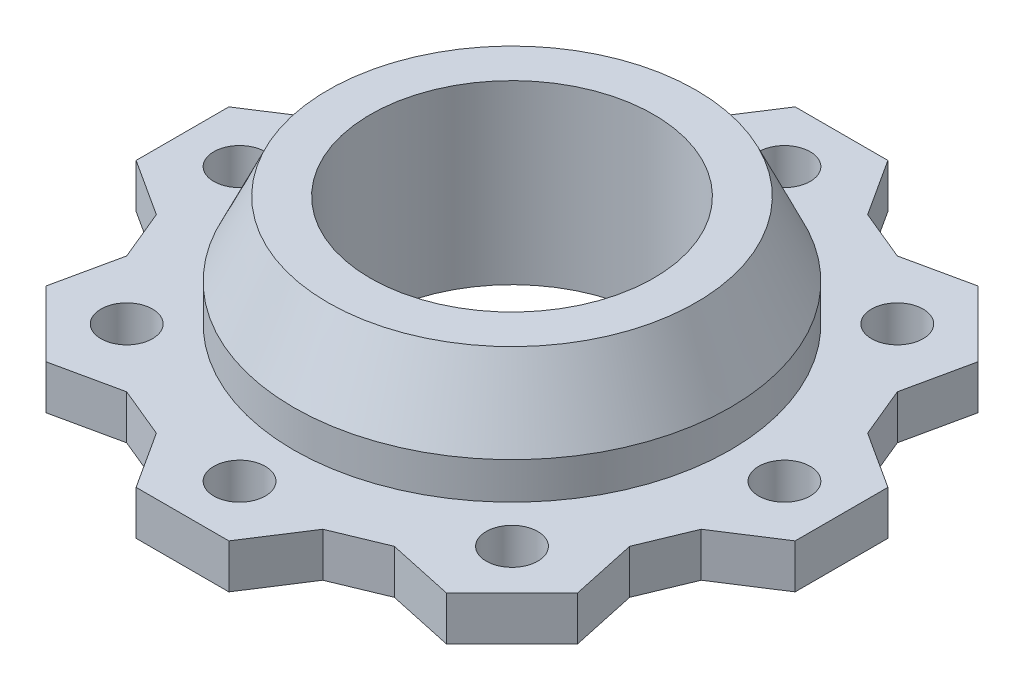
from build123d import *

# Parameters (mm, degrees)
SKETCH2_R           = 3.5
SKETCH2_R_2         = 19.25
BOSS_EXTRUDE1_DEPTH = 6


with BuildPart() as part:
    # Sketch2 → Boss-Extrude1 (new body)
    with BuildSketch(Plane(origin=(0, 0, 0), x_dir=(1, 0, 0), z_dir=(0, 1, 0))):
        Polygon((27.188255737, 36.09780118), (18.172644276, 34.153257531), (11.3, 37), (6.3, 44.75), (-6.3, 44.75), (-11.3, 37), (-18.172644276, 34.153257531), (-27.188255737, 36.09780118), (-36.09780118, 27.188255737), (-34.153257531, 18.172644276), (-37, 11.3), (-44.75, 6.3), (-44.75, -6.3), (-37, -11.3), (-34.153257531, -18.172644276), (-36.09780118, -27.188255737), (-27.188255737, -36.09780118), (-18.172644276, -34.153257531), (-11.3, -37), (-6.3, -44.75), (6.3, -44.75), (11.3, -37), (18.172644276, -34.153257531), (27.188255737, -36.09780118), (36.09780118, -27.188255737), (34.153257531, -18.172644276), (37, -11.3), (44.75, -6.3), (44.75, 6.3), (37, 11.3), (34.153257531, 18.172644276), (36.09780118, 27.188255737), align=None)
        with Locations(Location((0, 37, 0), (0, 0, 270))):
            Circle(SKETCH2_R, mode=Mode.SUBTRACT)
        with Locations(Location((26.162950904, 26.162950904, 0), (0, 0, 270))):
            Circle(SKETCH2_R, mode=Mode.SUBTRACT)
        with Locations(Location((37, 0, 0), (0, 0, 270))):
            Circle(SKETCH2_R, mode=Mode.SUBTRACT)
        with Locations(Location((26.162950904, -26.162950904, 0), (0, 0, 270))):
            Circle(SKETCH2_R, mode=Mode.SUBTRACT)
        with Locations(Location((0, -37, 0), (0, 0, 270))):
            Circle(SKETCH2_R, mode=Mode.SUBTRACT)
        with Locations(Location((-26.162950904, -26.162950904, 0), (0, 0, 270))):
            Circle(SKETCH2_R, mode=Mode.SUBTRACT)
        with Locations(Location((-37, 0, 0), (0, 0, 270))):
            Circle(SKETCH2_R, mode=Mode.SUBTRACT)
        with Locations(Location((-26.162950904, 26.162950904, 0), (0, 0, 270))):
            Circle(SKETCH2_R, mode=Mode.SUBTRACT)
        with Locations(Location((0, 0, 0), (0, 0, 270))):
            Circle(SKETCH2_R_2, mode=Mode.SUBTRACT)
    extrude(amount=BOSS_EXTRUDE1_DEPTH)

    # Sketch3 → Revolve1 (revolve)
    with BuildSketch(Plane.XY, mode=Mode.PRIVATE) as revolve1_sk:
        Polygon((-19.25, 21), (-25, 21), (-29.663076582, 11), (-29.663076582, -3), (-19.25, -3), align=None)
    revolve(revolve1_sk.sketch.rotate(Axis((0, 33.758219329, 0), (0, -1, 0)), 270), axis=Axis((0, 33.758219329, 0), (0, -1, 0)))


solid = part.part
